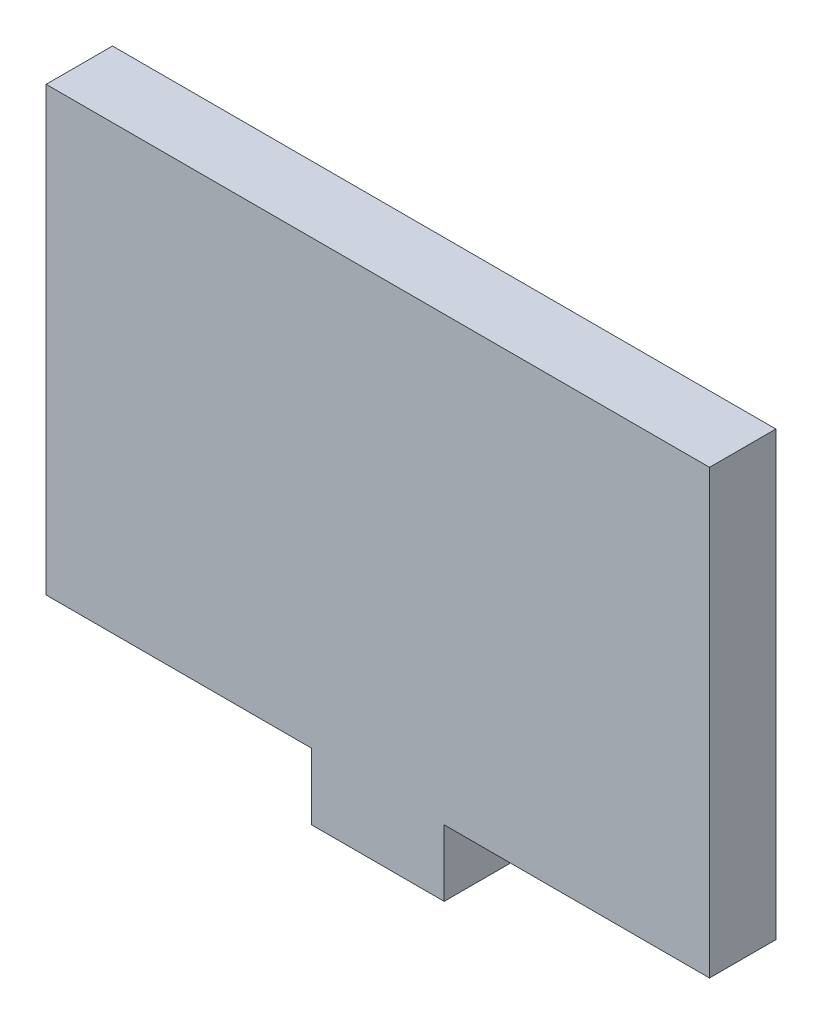
from build123d import *

# Parameters (mm, degrees)
BOSS_EXTRUDE1_DEPTH = 3


with BuildPart() as part:
    # Sketch2 → Boss-Extrude1 (new body)
    with BuildSketch(Plane.XY):
        Polygon((3, -10), (15, -10), (15, 10), (-15, 10), (-15, -10), (-3, -10), (-3, -13), (3, -13), align=None)
    extrude(amount=BOSS_EXTRUDE1_DEPTH)


solid = part.part
